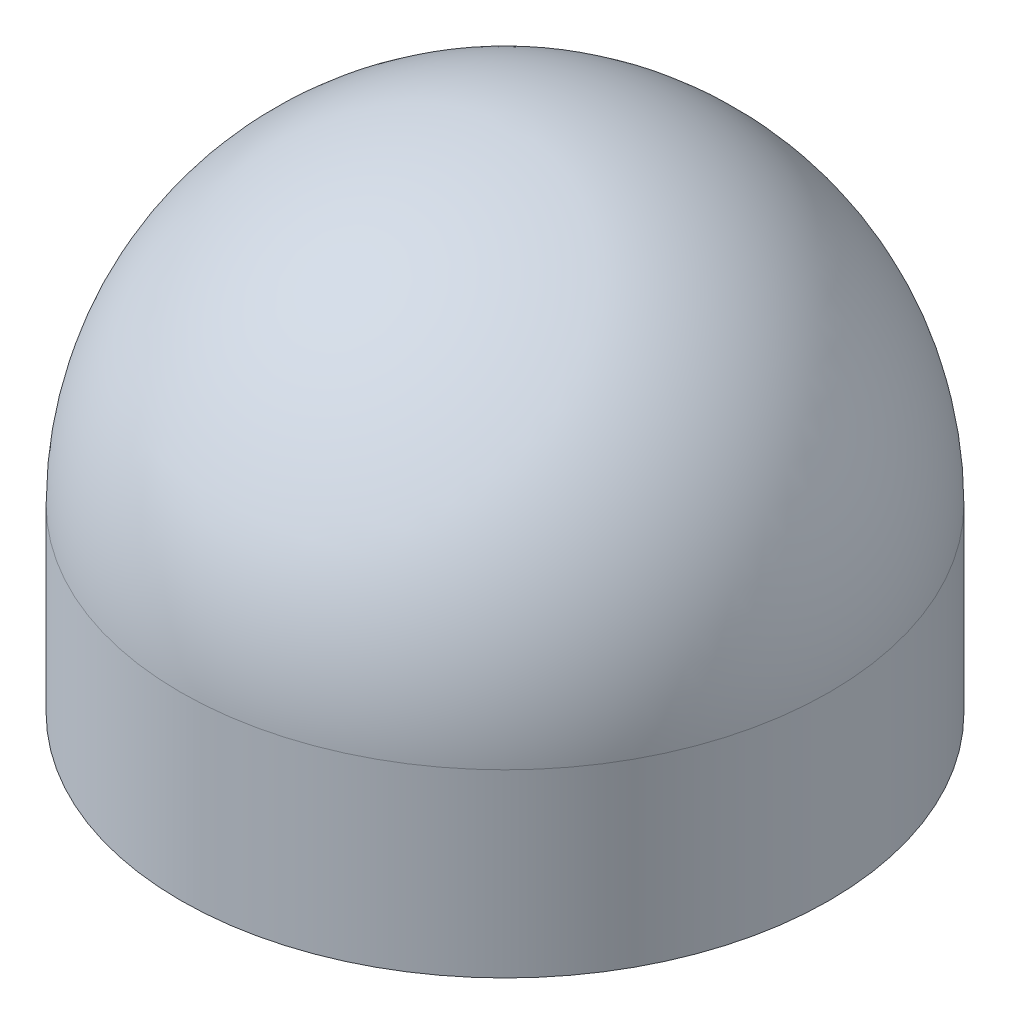
from build123d import *

# Parameters (mm, degrees)
REVOLVE_1_ANGLE = 180
SKETCH_6_W      = 9
SKETCH_6_H      = 5
SKETCH_7_W      = 8
SKETCH_7_H      = 4.896318498


with BuildPart() as part:
    # 草图1 → 旋转1 (revolve)
    with BuildSketch(Plane(origin=(0, 0, 0), x_dir=(1, 0, 0), z_dir=(0, 1, 0))):
        with BuildLine():
            Line((0, 9), (0, -9))
            ThreePointArc((0, -9), (9, 0), (0, 9))
        make_face()
    revolve(axis=Axis((0, 0, -9), (0, 0, 1)), revolution_arc=REVOLVE_1_ANGLE)

    # 草图6 → 旋转2 (revolve)
    with BuildSketch(Plane(origin=(0, 0, 0), x_dir=(0, 0, -1), z_dir=(1, 0, 0)), mode=Mode.PRIVATE) as revolve_2_sk:
        with Locations((4.5, -2.5)):
            Rectangle(SKETCH_6_W, SKETCH_6_H)
    revolve(revolve_2_sk.sketch.rotate(Axis((0, 0, 0), (0, -1, 0)), 180), axis=Axis((0, 0, 0), (0, -1, 0)))

    # 草图7 → 切除-旋转2 (revolve, cut)
    with BuildSketch(Plane(origin=(0, 0, 0), x_dir=(0, 0, -1), z_dir=(1, 0, 0)), mode=Mode.PRIVATE) as cut_revolve_2_sk:
        with Locations((4, -2.551840751)):
            Rectangle(SKETCH_7_W, SKETCH_7_H)
    revolve(cut_revolve_2_sk.sketch.rotate(Axis((0, -0.103681502, 0), (0, -1, 0)), 180), axis=Axis((0, -0.103681502, 0), (0, -1, 0)), mode=Mode.SUBTRACT)


solid = part.part
